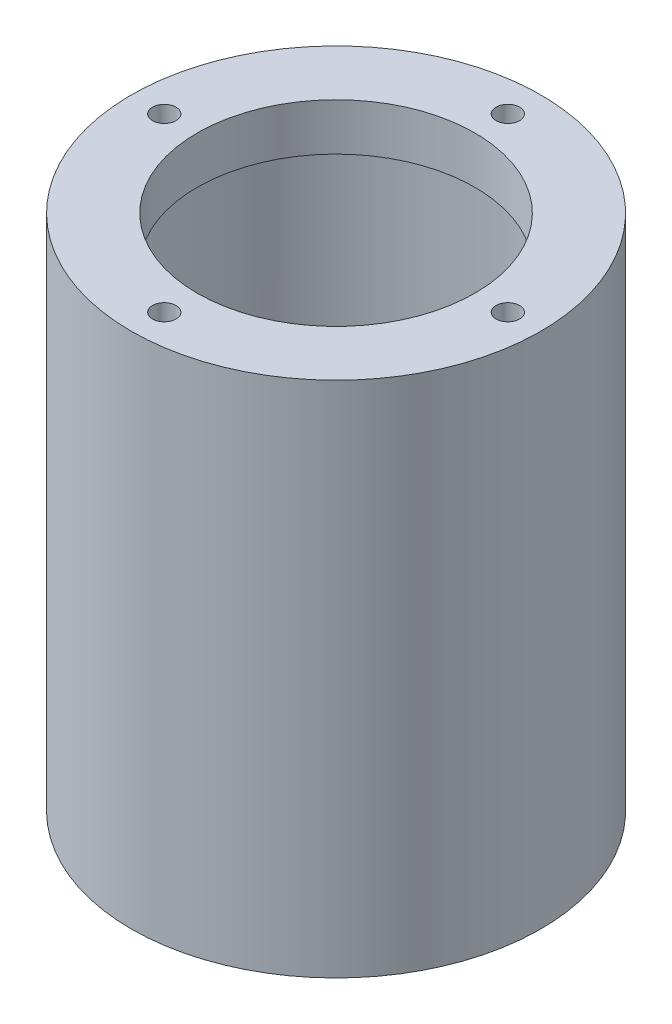
from build123d import *

# Parameters (mm, degrees)
SKETCH_1_R          = 21.75
SKETCH_1_R_2        = 14.75
EXTRUDE_1_DEPTH     = 55
CUT_EXTRUDE_START   = -5
SKETCH_2_R          = 18.75
SKETCH_2_R_2        = 14.75
CUT_EXTRUDE_1_DEPTH = 59.016862823
SKETCH_3_R          = 1.25
CUT_EXTRUDE_2_DEPTH = 5


with BuildPart() as part:
    # ｽｹｯﾁ1 → ﾎﾞｽ - 押し出し1 (new body)
    with BuildSketch(Plane(origin=(0, 0, 0), x_dir=(1, 0, 0), z_dir=(0, 1, 0))):
        with Locations(Location((0, 0, 0), (0, 0, 270))):
            Circle(SKETCH_1_R)
        with Locations(Location((0, 0, 0), (0, 0, 270))):
            Circle(SKETCH_1_R_2, mode=Mode.SUBTRACT)
    extrude(amount=EXTRUDE_1_DEPTH)

    # ｽｹｯﾁ2 → ｶｯﾄ - 押し出し1 (cut, through all)
    with BuildSketch(Plane(origin=(0, 55, 0), x_dir=(1, 0, 0), z_dir=(0, 1, 0)).offset(CUT_EXTRUDE_START)):
        with Locations(Location((0, 0, 0), (0, 0, 270))):
            Circle(SKETCH_2_R)
        with Locations(Location((0, 0, 0), (0, 0, 270))):
            Circle(SKETCH_2_R_2, mode=Mode.SUBTRACT)
    extrude(amount=-CUT_EXTRUDE_1_DEPTH, mode=Mode.SUBTRACT)

    # ｽｹｯﾁ3 → ｶｯﾄ - 押し出し2 (cut)
    with BuildSketch(Plane(origin=(0, 55, 0), x_dir=(1, 0, 0), z_dir=(0, 1, 0))):
        with Locations(Location((0, 18.25, 0), (0, 0, 270))):
            Circle(SKETCH_3_R)
        with Locations(Location((18.25, 0, 0), (0, 0, 270))):
            Circle(SKETCH_3_R)
        with Locations(Location((0, -18.25, 0), (0, 0, 270))):
            Circle(SKETCH_3_R)
        with Locations(Location((-18.25, 0, 0), (0, 0, 270))):
            Circle(SKETCH_3_R)
    extrude(amount=-CUT_EXTRUDE_2_DEPTH, mode=Mode.SUBTRACT)


solid = part.part
